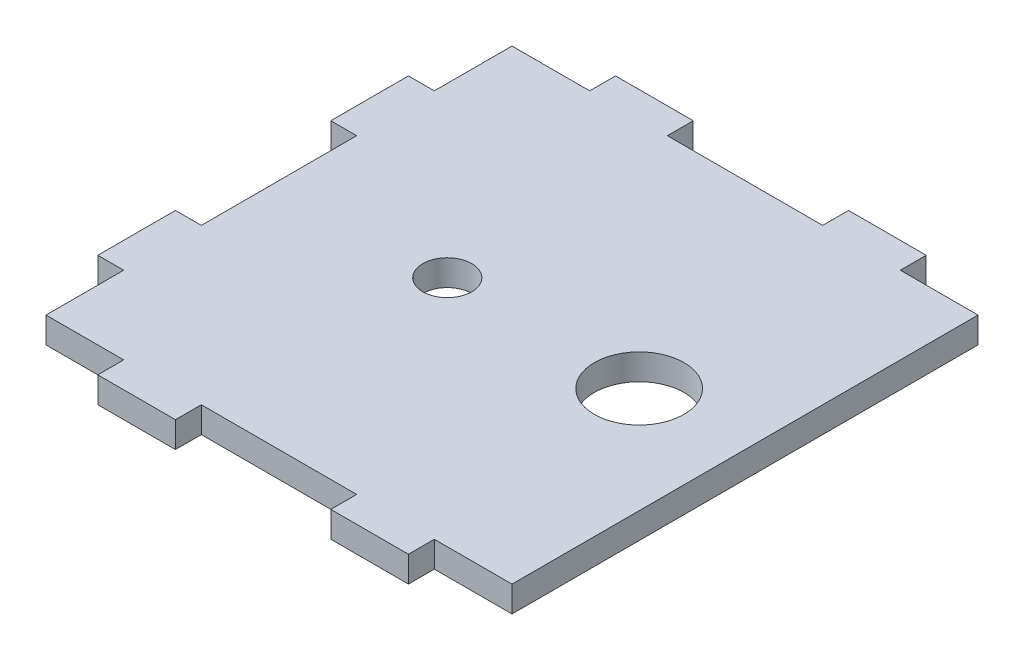
from build123d import *

# Parameters (mm, degrees)
BOSS_EXTRUDE1_DEPTH = 6.35
SKETCH2_R           = 11
SKETCH2_R_2         = 5.999988
CUT_EXTRUDE1_DEPTH  = 167.316670842


with BuildPart() as part:
    # Sketch1 → Boss-Extrude1 (new body)
    with BuildSketch(Plane(origin=(0, 0, 0), x_dir=(1, 0, 0), z_dir=(0, 1, 0))):
        Polygon((0, 0), (19.05, 0), (19.05, -6.35), (38.1, -6.35), (38.1, 0), (76.2, 0), (76.2, -6.35), (95.25, -6.35), (95.25, 0), (114.3, 0), (114.3, 114.3), (95.25, 114.3), (95.25, 120.65), (76.2, 120.65), (76.2, 114.3), (38.1, 114.3), (38.1, 120.65), (19.05, 120.65), (19.05, 114.3), (0, 114.3), (0, 95.25), (-6.35, 95.25), (-6.35, 76.2), (0, 76.2), (0, 38.1), (-6.35, 38.1), (-6.35, 19.05), (0, 19.05), align=None)
    extrude(amount=-BOSS_EXTRUDE1_DEPTH)

    # Sketch2 → Cut-Extrude1 (cut, through all)
    with BuildSketch(Plane(origin=(0, 0, 0), x_dir=(1, 0, 0), z_dir=(0, 1, 0))):
        with Locations(Location((88.3412, 57.15, 0), (0, 0, 270))):
            Circle(SKETCH2_R)
        with Locations(Location((41.275, 57.15, 0), (0, 0, 270))):
            Circle(SKETCH2_R_2)
    extrude(amount=-CUT_EXTRUDE1_DEPTH, mode=Mode.SUBTRACT)


solid = part.part
